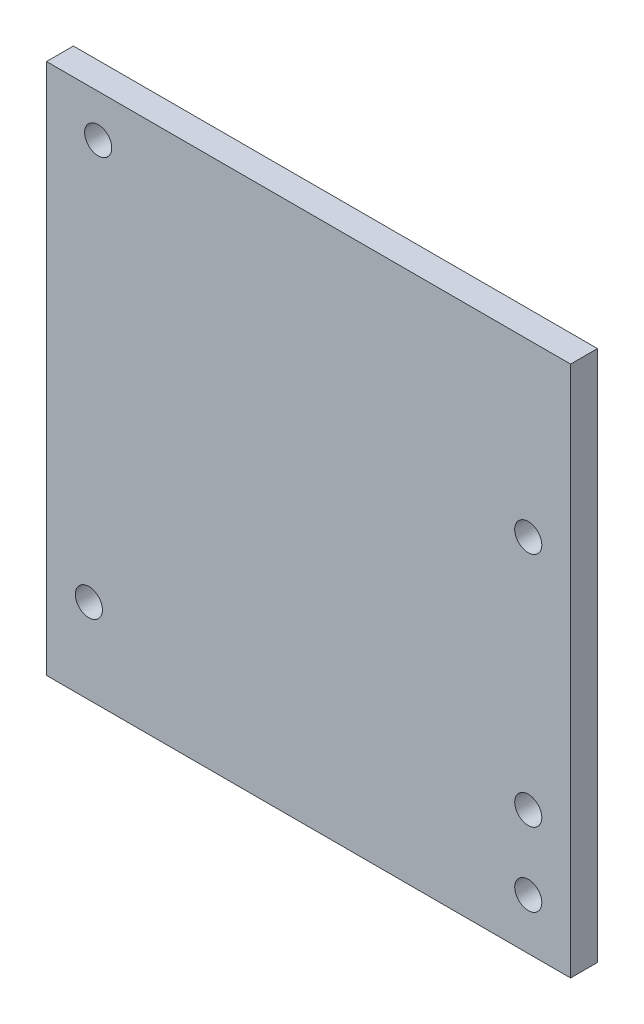
from build123d import *

# Parameters (mm, degrees)
SKETCH1_W           = 61.9
SKETCH1_H           = 62.8
SKETCH1_R           = 1.6
BOSS_EXTRUDE1_DEPTH = 3.175


with BuildPart() as part:
    # Sketch1 → Boss-Extrude1 (new body)
    with BuildSketch(Plane.XY):
        with Locations((30.95, 31.4)):
            Rectangle(SKETCH1_W, SKETCH1_H)
        with Locations((6.1, 57.8)):
            Circle(SKETCH1_R, mode=Mode.SUBTRACT)
        with Locations((5, 10)):
            Circle(SKETCH1_R, mode=Mode.SUBTRACT)
        with Locations((56.9, 42.6)):
            Circle(SKETCH1_R, mode=Mode.SUBTRACT)
        with Locations((56.9, 14.7)):
            Circle(SKETCH1_R, mode=Mode.SUBTRACT)
        with Locations((56.9, 6)):
            Circle(SKETCH1_R, mode=Mode.SUBTRACT)
    extrude(amount=BOSS_EXTRUDE1_DEPTH)


solid = part.part
